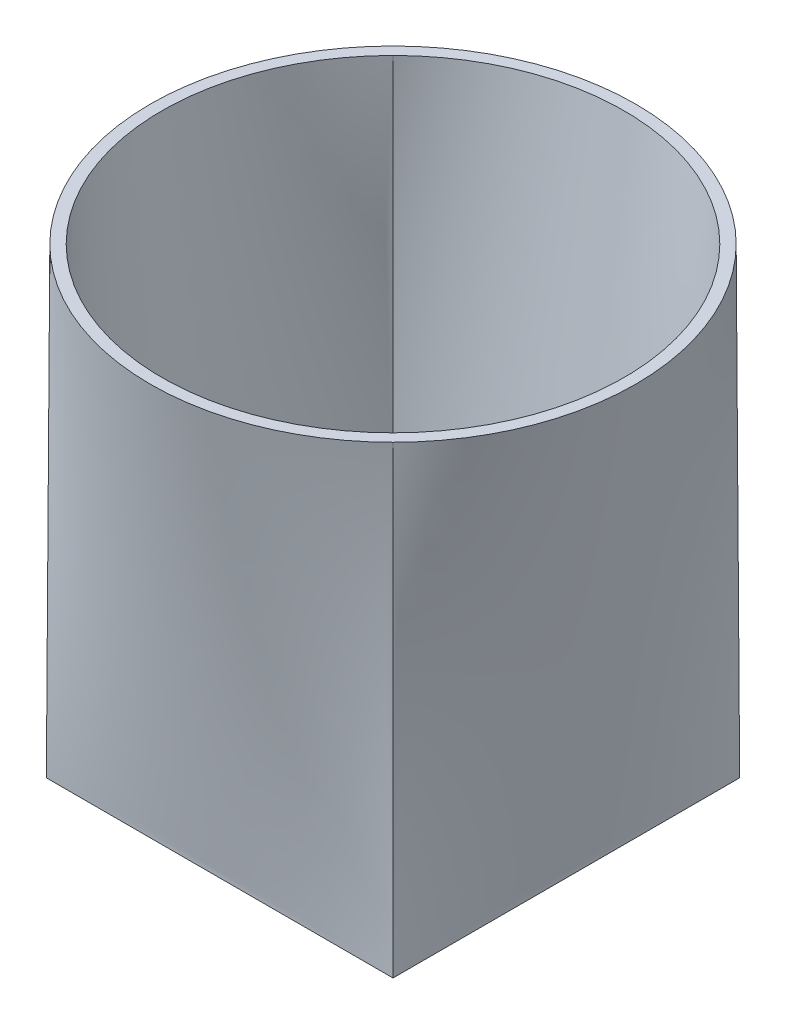
from build123d import *


with BuildPart() as part:
    # Sketch2 for Loft1 → Loft1 section 0
    with BuildSketch(Plane(origin=(0, 200, 0), x_dir=(1, 0, 0), z_dir=(0, 1, 0))):
        with BuildLine():
            # circular arc as an exact rational Bezier (weights 1, cos(half-angle), 1)
            Bezier((-74.246212025, 74.246212025), (0, 148.492424048), (74.246212025, 74.246212025), weights=[1, 0.707106781, 1])
            Bezier((74.246212025, 74.246212025), (148.492424048, 0), (74.246212025, -74.246212025), weights=[1, 0.707106781, 1])
            Bezier((74.246212025, -74.246212025), (0, -148.492424048), (-74.246212025, -74.246212025), weights=[1, 0.707106781, 1])
            Bezier((-74.246212025, -74.246212025), (-148.492424048, 0), (-74.246212025, 74.246212025), weights=[1, 0.707106781, 1])
        make_face()
    # Sketch1 → Loft1 section 1
    with BuildSketch(Plane(origin=(0, 0, 0), x_dir=(1, 0, 0), z_dir=(0, 1, 0))):
        with BuildLine():
            Line((-75, 75), (75, 75))
            Line((75, 75), (75, -75))
            Line((75, -75), (-75, -75))
            Line((-75, -75), (-75, 75))
        make_face()
    loft()

    # Sketch4 → Cut-Loft1 section 0
    with BuildSketch(Plane.XZ):
        with BuildLine():
            Line((-72.5, 72.5), (72.5, 72.5))
            Line((72.5, 72.5), (72.5, -72.5))
            Line((72.5, -72.5), (-72.5, -72.5))
            Line((-72.5, -72.5), (-72.5, 72.5))
        make_face()
    # Sketch3 for Cut-Loft1 → Cut-Loft1 section 1
    with BuildSketch(Plane(origin=(0, 200, 0), x_dir=(1, 0, 0), z_dir=(0, 1, 0))):
        with BuildLine():
            Bezier((-70.710678119, -70.710678119), (0, -141.421356236), (70.710678119, -70.710678119), weights=[1, 0.707106781, 1])
            Bezier((70.710678119, -70.710678119), (141.421356236, 0), (70.710678119, 70.710678119), weights=[1, 0.707106781, 1])
            Bezier((70.710678119, 70.710678119), (0, 141.421356236), (-70.710678119, 70.710678119), weights=[1, 0.707106781, 1])
            Bezier((-70.710678119, 70.710678119), (-141.421356236, 0), (-70.710678119, -70.710678119), weights=[1, 0.707106781, 1])
        make_face()
    loft(mode=Mode.SUBTRACT)


solid = part.part
